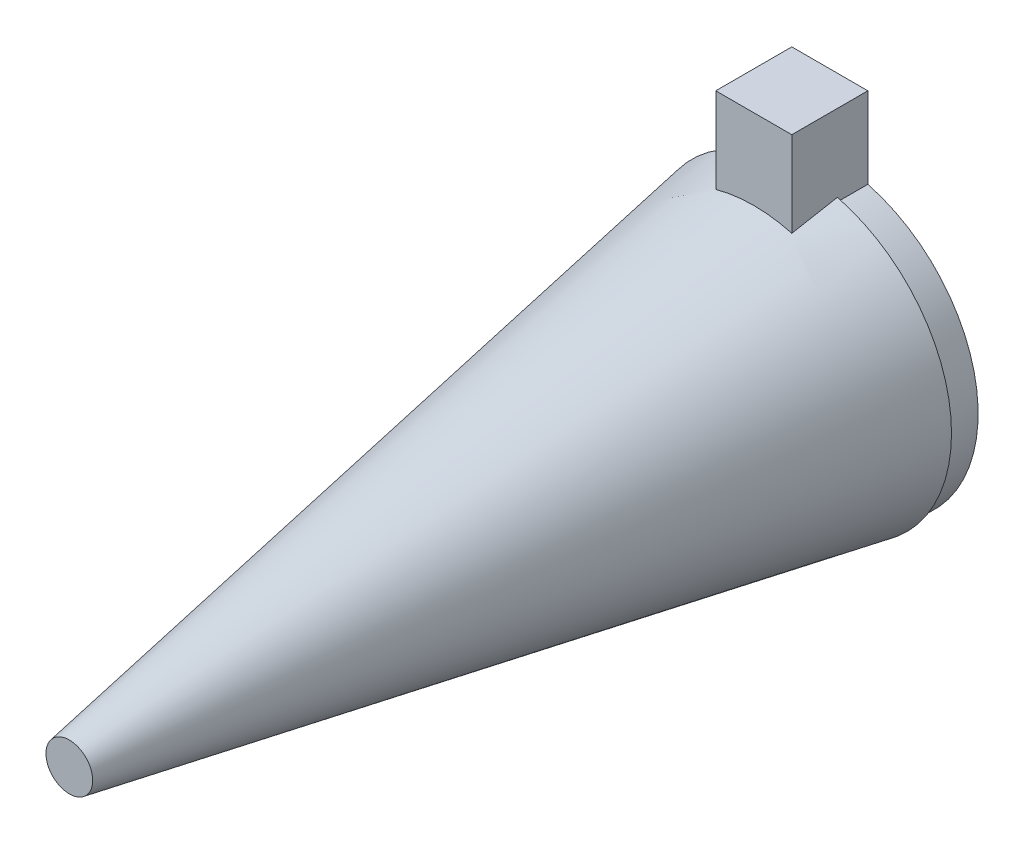
from build123d import *

# Parameters (mm, degrees)
SKETCH1_R           = 9.75
SKETCH1_R_2         = 0.5
BOSS_EXTRUDE1_DEPTH = 2
SKETCH3_R           = 10
BOSS_EXTRUDE2_DEPTH = 48
BOSS_EXTRUDE2_TAPER = 10
BOSS_EXTRUDE3_DEPTH = 5
SKETCH5_W           = 5
SKETCH5_H           = 5
BOSS_EXTRUDE4_DEPTH = 6


with BuildPart() as part:
    # Sketch1 → Boss-Extrude1 (new body)
    with BuildSketch(Plane.XY):
        with Locations((4.234062462, -7.179497219)):
            Circle(SKETCH1_R)
        with Locations((4.234062462, 0.270502781)):
            Circle(SKETCH1_R_2, mode=Mode.SUBTRACT)
        with Locations((9.502007982, -1.911551699)):
            Circle(SKETCH1_R_2, mode=Mode.SUBTRACT)
        with Locations((11.684062462, -7.179497219)):
            Circle(SKETCH1_R_2, mode=Mode.SUBTRACT)
        with Locations((9.502007982, -12.447442738)):
            Circle(SKETCH1_R_2, mode=Mode.SUBTRACT)
        with Locations((4.234062462, -14.629497219)):
            Circle(SKETCH1_R_2, mode=Mode.SUBTRACT)
        with Locations((-1.033883058, -12.447442738)):
            Circle(SKETCH1_R_2, mode=Mode.SUBTRACT)
        with Locations((-3.215937538, -7.179497219)):
            Circle(SKETCH1_R_2, mode=Mode.SUBTRACT)
        with Locations((-1.033883058, -1.911551699)):
            Circle(SKETCH1_R_2, mode=Mode.SUBTRACT)
    extrude(amount=BOSS_EXTRUDE1_DEPTH)

    # Sketch3 → Boss-Extrude2 (add)
    with BuildSketch(Plane.XY.offset(2)):
        with Locations((4.234062462, -7.179497219)):
            Circle(SKETCH3_R)
    extrude(amount=BOSS_EXTRUDE2_DEPTH, taper=BOSS_EXTRUDE2_TAPER)

    # Sketch4 → Boss-Extrude3 (add)
    with BuildSketch(Plane(origin=(0, 0, 0), x_dir=(-1, 0, 0), z_dir=(0, 0, -1))):
        with BuildLine():
            ThreePointArc((-6.734062462, 2.244541194), (-5.494642781, 2.48866896), (-4.234062462, 2.570502781))
            Line((-4.234062462, 2.570502781), (-4.234062462, 7.570502781))
            Line((-4.234062462, 7.570502781), (-6.734062462, 7.570502781))
            Line((-6.734062462, 7.570502781), (-6.734062462, 2.244541194))
        make_face()
        with BuildLine():
            Line((-4.234062462, 7.570502781), (-4.234062462, 2.570502781))
            ThreePointArc((-4.234062462, 2.570502781), (-2.973482144, 2.48866896), (-1.734062462, 2.244541194))
            Line((-1.734062462, 2.244541194), (-1.734062462, 7.570502781))
            Line((-1.734062462, 7.570502781), (-4.234062462, 7.570502781))
        make_face()
    extrude(amount=-BOSS_EXTRUDE3_DEPTH)

    # Sketch5 → Boss-Extrude4 (add)
    with BuildSketch(Plane(origin=(0, 7.570502781, 0), x_dir=(1, 0, 0), z_dir=(0, 1, 0))):
        with Locations((4.234062462, -2.5)):
            Rectangle(SKETCH5_W, SKETCH5_H)
    extrude(amount=-BOSS_EXTRUDE4_DEPTH)


solid = part.part
